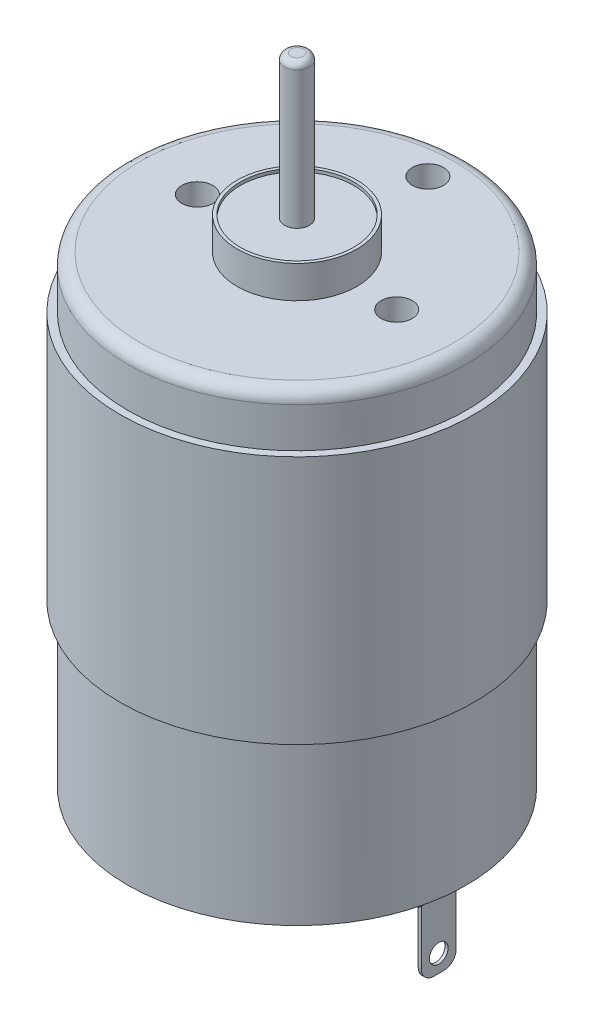
from build123d import *

# Parameters (mm, degrees)
ESBO_O1_R                = 13.6
RESSALTO_EXTRUS_O1_DEPTH = 37.2
ESBO_O2_R                = 4.8
RESSALTO_EXTRUS_O2_DEPTH = 2.6
ESBO_O3_R                = 4.55
CORTE_EXTRUS_O1_DEPTH    = 0.25
ESBO_O4_R                = 1
RESSALTO_EXTRUS_O3_DEPTH = 11.5
FILETE1_R                = 0.5
ESBO_O5_R                = 1.25
CORTE_EXTRUS_O2_DEPTH    = 2
ESBO_O6_R                = 1.25
CORTE_EXTRUS_O3_DEPTH    = 2
ESBO_O7_R                = 13.35
ESBO_O7_R_2              = 9.5
CORTE_EXTRUS_O4_DEPTH    = 0.25
FILETE2_R                = 0.2
RESSALTO_EXTRUS_O4_START = 2.2
ESBO_O8_R                = 4.8
RESSALTO_EXTRUS_O4_DEPTH = 2.2
CORTE_EXTRUS_O5_START    = -0.25
ESBO_O9_R                = 4.55
CORTE_EXTRUS_O5_DEPTH    = 0.25
RESSALTO_EXTRUS_O5_START = 2.3
ESBO_O10_R               = 1
RESSALTO_EXTRUS_O5_DEPTH = 2.3
FILETE3_R                = 0.5
FILETE4_R                = 1
ESBO_O11_W               = 1.5
ESBO_O11_H               = 4.5
RESSALTO_EXTRUS_O6_DEPTH = 1.5
ESBO_O12_W               = 0.25
ESBO_O12_H               = 2.8
RESSALTO_EXTRUS_O7_DEPTH = 6
ESBO_O13_R               = 0.75
CORTE_EXTRUS_O6_DEPTH    = 59.436402419
FILETE5_R                = 1
ESBO_O14_R               = 1
CORTE_EXTRUS_O7_DEPTH    = 2
CORTE_EXTRUS_O8_DEPTH    = 2
RESSALTO_EXTRUS_O8_START = -13
RESSALTO_EXTRUS_O8_DEPTH = 20


with BuildPart() as part:
    # Esboço1 → Ressalto-extrusão1 (new body)
    with BuildSketch(Plane(origin=(0, 0, 0), x_dir=(1, 0, 0), z_dir=(0, 1, 0))):
        with Locations(Location((0, 0, 0), (0, 0, 270))):
            Circle(ESBO_O1_R)
    extrude(amount=RESSALTO_EXTRUS_O1_DEPTH)

    # Esboço2 → Ressalto-extrusão2 (add)
    with BuildSketch(Plane(origin=(0, 37.2, 0), x_dir=(1, 0, 0), z_dir=(0, 1, 0))):
        with Locations(Location((0, 0, 0), (0, 0, 270))):
            Circle(ESBO_O2_R)
    extrude(amount=RESSALTO_EXTRUS_O2_DEPTH)

    # Esboço3 → Corte-extrusão1 (cut)
    with BuildSketch(Plane(origin=(0, 39.8, 0), x_dir=(1, 0, 0), z_dir=(0, 1, 0))):
        with Locations(Location((0, 0, 0), (0, 0, 270))):
            Circle(ESBO_O3_R)
    extrude(amount=-CORTE_EXTRUS_O1_DEPTH, mode=Mode.SUBTRACT)

    # Esboço4 → Ressalto-extrusão3 (add)
    with BuildSketch(Plane(origin=(0, 39.55, 0), x_dir=(1, 0, 0), z_dir=(0, 1, 0))):
        with Locations(Location((0, 0, 0), (0, 0, 270))):
            Circle(ESBO_O4_R)
    extrude(amount=RESSALTO_EXTRUS_O3_DEPTH)

    # Filete1
    filete1_edges = [part.edges().sort_by_distance(p)[0] for p in [
        (0, 51.05, -1),
    ]]
    fillet(filete1_edges, radius=FILETE1_R)

    # Esboço5 → Corte-extrusão2 (cut)
    with BuildSketch(Plane(origin=(0, 37.2, 0), x_dir=(1, 0, 0), z_dir=(0, 1, 0))):
        with Locations(Location((-8, 0, 0), (0, 0, 270))):
            Circle(ESBO_O5_R)
        with Locations(Location((8, 0, 0), (0, 0, 90))):
            Circle(ESBO_O5_R)
    extrude(amount=-CORTE_EXTRUS_O2_DEPTH, mode=Mode.SUBTRACT)

    # Esboço6 → Corte-extrusão3 (cut)
    with BuildSketch(Plane(origin=(0, 37.2, 0), x_dir=(1, 0, 0), z_dir=(0, 1, 0))):
        with Locations(Location((0, 10.5, 0), (0, 0, 270))):
            Circle(ESBO_O6_R)
    extrude(amount=-CORTE_EXTRUS_O3_DEPTH, mode=Mode.SUBTRACT)

    # Esboço7 → Corte-extrusão4 (cut)
    with BuildSketch(Plane.XZ):
        with Locations(Location((0, 0, 0), (0, 0, 270))):
            Circle(ESBO_O7_R)
        with Locations(Location((0, 0, 0), (0, 0, 270))):
            Circle(ESBO_O7_R_2, mode=Mode.SUBTRACT)
    extrude(amount=-CORTE_EXTRUS_O4_DEPTH, mode=Mode.SUBTRACT)

    # Filete2
    filete2_edges = [part.edges().sort_by_distance(p)[0] for p in [
        (0, 0, 9.5),
    ]]
    fillet(filete2_edges, radius=FILETE2_R)

    # Esboço8 → Ressalto-extrusão4 (add)
    with BuildSketch(Plane.XZ.offset(RESSALTO_EXTRUS_O4_START)):
        with Locations(Location((0, 0, 0), (0, 0, 90))):
            Circle(ESBO_O8_R)
    extrude(amount=-RESSALTO_EXTRUS_O4_DEPTH)

    # Esboço9 → Corte-extrusão5 (cut)
    with BuildSketch(Plane.XZ.offset(2.2).offset(CORTE_EXTRUS_O5_START)):
        with Locations(Location((0, 0, 0), (0, 0, 90))):
            Circle(ESBO_O9_R)
    extrude(amount=CORTE_EXTRUS_O5_DEPTH, mode=Mode.SUBTRACT)

    # Esboço10 → Ressalto-extrusão5 (add)
    with BuildSketch(Plane.XZ.offset(1.95).offset(RESSALTO_EXTRUS_O5_START)):
        with Locations(Location((0, 0, 0), (0, 0, 90))):
            Circle(ESBO_O10_R)
    extrude(amount=-RESSALTO_EXTRUS_O5_DEPTH)

    # Filete3
    filete3_edges = [part.edges().sort_by_distance(p)[0] for p in [
        (0, -4.25, -1),
    ]]
    fillet(filete3_edges, radius=FILETE3_R)

    # Filete4
    filete4_edges = [part.edges().sort_by_distance(p)[0] for p in [
        (0, 37.2, -13.6),
    ]]
    fillet(filete4_edges, radius=FILETE4_R)

    # Esboço11 → Ressalto-extrusão6 (add)
    with BuildSketch(Plane.XZ.offset(-0.25)):
        with Locations((-11.25, 0)):
            Rectangle(ESBO_O11_W, ESBO_O11_H)
        with Locations((11.25, 0)):
            Rectangle(ESBO_O11_W, ESBO_O11_H)
    extrude(amount=RESSALTO_EXTRUS_O6_DEPTH)

    # Esboço12 → Ressalto-extrusão7 (add)
    with BuildSketch(Plane.XZ.offset(1.25)):
        with Locations((-11.25, 0)):
            Rectangle(ESBO_O12_W, ESBO_O12_H)
        with Locations((11.25, 0)):
            Rectangle(ESBO_O12_W, ESBO_O12_H)
    extrude(amount=RESSALTO_EXTRUS_O7_DEPTH)

    # Esboço13 → Corte-extrusão6 (cut, through all)
    with BuildSketch(Plane.ZY.offset(11.375)):
        with Locations((0, -5.85)):
            Circle(ESBO_O13_R)
    extrude(amount=-CORTE_EXTRUS_O6_DEPTH, mode=Mode.SUBTRACT)

    # Filete5
    filete5_edges = [part.edges().sort_by_distance(p)[0] for p in [
        (-11.25, -7.25, 1.4),
        (-11.25, -7.25, -1.4),
        (11.25, -7.25, 1.4),
        (11.25, -7.25, -1.4),
    ]]
    fillet(filete5_edges, radius=FILETE5_R)

    # Esboço14 → Corte-extrusão7 (cut)
    with BuildSketch(Plane.XZ):
        with Locations(Location((1.302361333, 7.386058148, 0), (0, 0, 270))):
            Circle(ESBO_O14_R)
        with Locations(Location((-1.302361333, -7.386058148, 0), (0, 0, 270))):
            Circle(ESBO_O14_R)
    extrude(amount=-CORTE_EXTRUS_O7_DEPTH, mode=Mode.SUBTRACT)

    # Esboço15 → Corte-extrusão8 (cut)
    with BuildSketch(Plane.XZ):
        with BuildLine():
            ThreePointArc((-5.463694682, 6.511377767), (-6.962792376, 4.875399709), (-7.987387277, 2.907171218))
            ThreePointArc((-7.987387277, 2.907171218), (-7.688551038, 2.266314836), (-7.047694656, 2.565151075))
            ThreePointArc((-7.047694656, 2.565151075), (-6.143640332, 4.301823273), (-4.820907073, 5.745333323))
            ThreePointArc((-4.820907073, 5.745333323), (-4.759278656, 6.44974935), (-5.463694682, 6.511377767))
        make_face()
        with BuildLine():
            ThreePointArc((4.820907073, -5.745333323), (6.143640332, -4.301823273), (7.047694656, -2.565151075))
            ThreePointArc((7.047694656, -2.565151075), (7.688551038, -2.266314836), (7.987387277, -2.907171218))
            ThreePointArc((7.987387277, -2.907171218), (6.962792376, -4.875399709), (5.463694682, -6.511377767))
            ThreePointArc((5.463694682, -6.511377767), (4.759278656, -6.44974935), (4.820907073, -5.745333323))
        make_face()
    extrude(amount=-CORTE_EXTRUS_O8_DEPTH, mode=Mode.SUBTRACT)

    # Esboço17 → Ressalto-extrusão8 (add)
    with BuildSketch(Plane.XZ.offset(RESSALTO_EXTRUS_O8_START)):
        with BuildLine():
            Line((-1.4, -13.527749258), (-1.4, -14.130817386))
            ThreePointArc((-1.4, -14.130817386), (0, 14.2), (1.4, -14.130817386))
            Line((1.4, -14.130817386), (1.4, -13.527749258))
            ThreePointArc((1.4, -13.527749258), (0, 13.6), (-1.4, -13.527749258))
        make_face()
    extrude(amount=-RESSALTO_EXTRUS_O8_DEPTH)


solid = part.part
